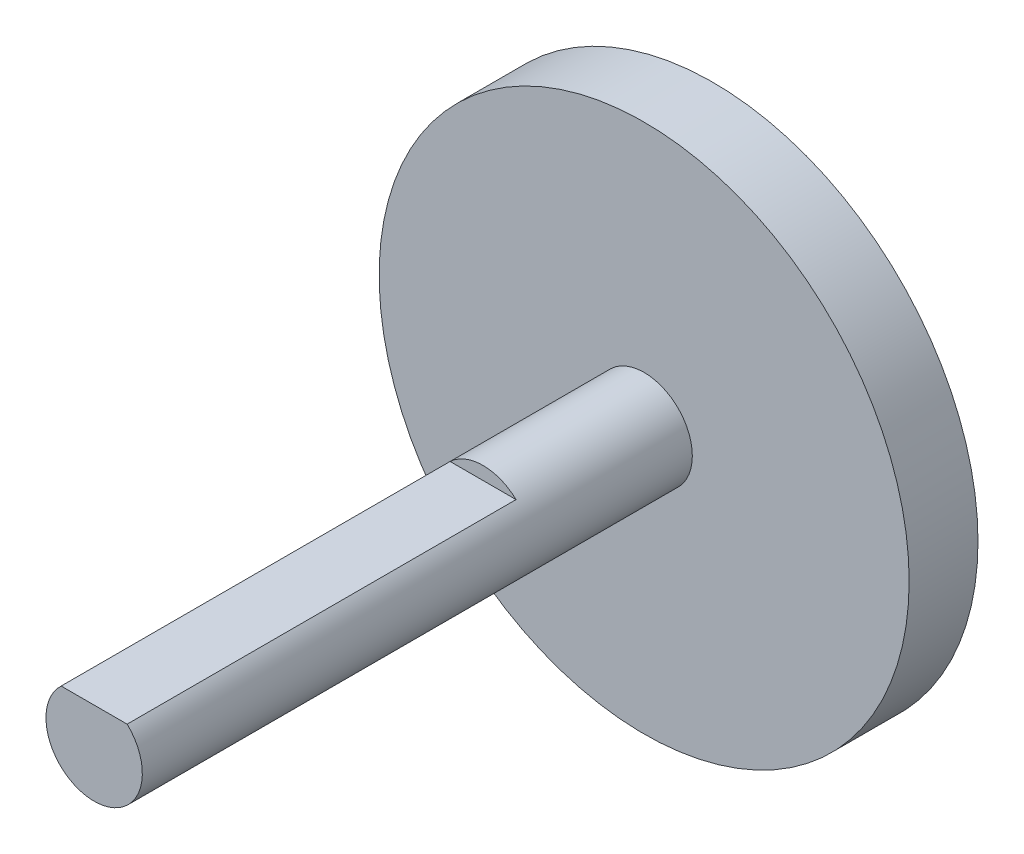
from build123d import *

# Parameters (mm, degrees)
CROQUIS1_R              = 19.25
SALIENTE_EXTRUIR1_DEPTH = 5
CROQUIS2_R              = 3.5
SALIENTE_EXTRUIR2_DEPTH = 11.7
SALIENTE_EXTRUIR3_DEPTH = 28.25


with BuildPart() as part:
    # Croquis1 → Saliente-Extruir1 (new body)
    with BuildSketch(Plane.XY):
        Circle(CROQUIS1_R)
    extrude(amount=SALIENTE_EXTRUIR1_DEPTH)

    # Croquis2 → Saliente-Extruir2 (add)
    with BuildSketch(Plane.XY.offset(5)):
        Circle(CROQUIS2_R)
    extrude(amount=SALIENTE_EXTRUIR2_DEPTH)

    # Croquis3 → Saliente-Extruir3 (add)
    with BuildSketch(Plane.XY.offset(16.7)):
        with BuildLine():
            Line((-2.397394419, 2.55), (2.397394419, 2.55))
            ThreePointArc((2.397394419, 2.55), (0, -3.5), (-2.397394419, 2.55))
        make_face()
    extrude(amount=SALIENTE_EXTRUIR3_DEPTH)


solid = part.part
